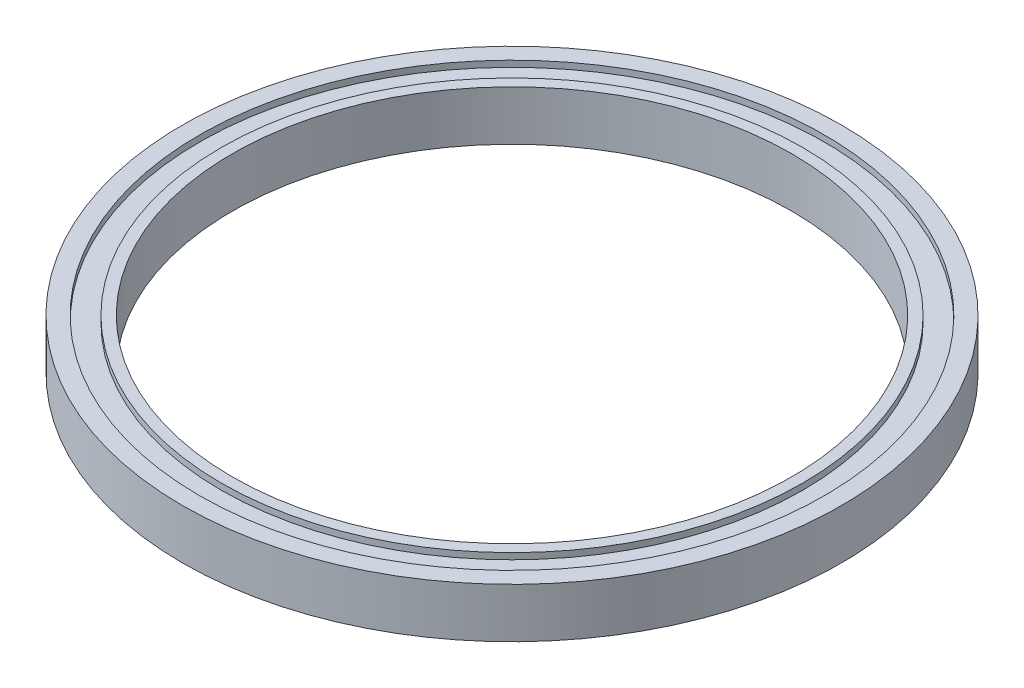
from build123d import *

# Parameters (mm, degrees)
SKETCH_1_R          = 53
SKETCH_1_R_2        = 45
EXTRUDE_1_DEPTH     = 8
SKETCH_2_R          = 50.25
SKETCH_2_R_2        = 46.75
CUT_EXTRUDE_1_DEPTH = 1
CUT_EXTRUDE_START   = -7
SKETCH_2_2_R        = 50.25
SKETCH_2_2_R_2      = 46.75
CUT_EXTRUDE_2_DEPTH = 1


with BuildPart() as part:
    # 草图1 → 凸台-拉伸1 (new body)
    with BuildSketch(Plane(origin=(0, 0, 0), x_dir=(1, 0, 0), z_dir=(0, 1, 0))):
        with Locations(Location((0, 0, 0), (0, 0, 270))):
            Circle(SKETCH_1_R)
        with Locations(Location((0, 0, 0), (0, 0, 270))):
            Circle(SKETCH_1_R_2, mode=Mode.SUBTRACT)
    extrude(amount=EXTRUDE_1_DEPTH)

    # 草图2 → 切除-拉伸1 (cut)
    with BuildSketch(Plane(origin=(0, 8, 0), x_dir=(1, 0, 0), z_dir=(0, 1, 0))):
        with Locations(Location((0, 0, 0), (0, 0, 270))):
            Circle(SKETCH_2_R)
        with Locations(Location((0, 0, 0), (0, 0, 270))):
            Circle(SKETCH_2_R_2, mode=Mode.SUBTRACT)
    extrude(amount=-CUT_EXTRUDE_1_DEPTH, mode=Mode.SUBTRACT)

    # 草图2<2> → 切除-拉伸2 (cut)
    with BuildSketch(Plane(origin=(0, 8, 0), x_dir=(1, 0, 0), z_dir=(0, 1, 0)).offset(CUT_EXTRUDE_START)):
        with Locations(Location((0, 0, 0), (0, 0, 270))):
            Circle(SKETCH_2_2_R)
        with Locations(Location((0, 0, 0), (0, 0, 270))):
            Circle(SKETCH_2_2_R_2, mode=Mode.SUBTRACT)
    extrude(amount=-CUT_EXTRUDE_2_DEPTH, mode=Mode.SUBTRACT)


solid = part.part
